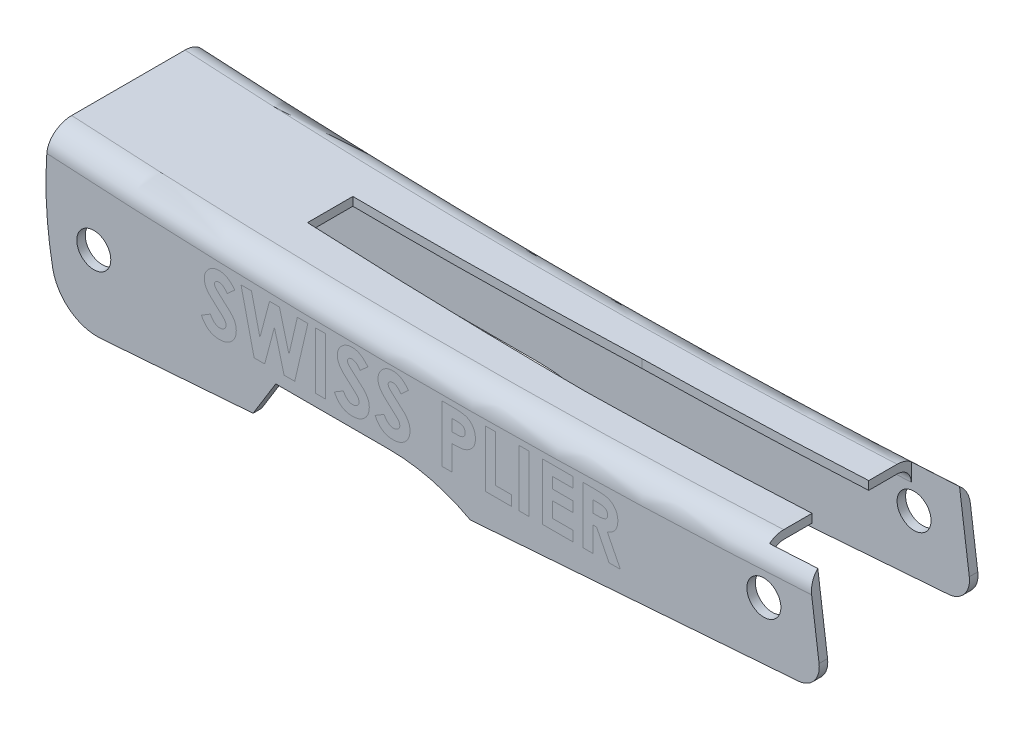
from build123d import *

# Parameters (mm, degrees)
BOSS_EXTRUDE1_DEPTH = 7
FILLET1_R           = 2
FILLET2_R           = 4
SHELL1_T            = -0.75
SKETCH4_R           = 1.5
CUT_EXTRUDE1_DEPTH  = 71.716642035
CUT_EXTRUDE2_DEPTH  = 14
CUT_EXTRUDE3_DEPTH  = 71.716642035


with BuildPart() as part:
    # Sketch3 → Boss-Extrude1 (new, symmetric)
    with BuildSketch(Plane.XY):
        with BuildLine():
            Line((67, 0), (68.2, -9))
            Line((68.2, -9), (1.2, -14))
            Line((1.2, -14), (0, 0))
            ThreePointArc((0, 0), (33.5, -1), (67, 0))
        make_face()
        with BuildLine():
            ThreePointArc((1.2, -14), (-0.147259987, -7.064050856), (0, 0))
            Line((0, 0), (1.2, -14))
        make_face()
    extrude(amount=BOSS_EXTRUDE1_DEPTH, both=True)

    # Fillet1
    fillet1_edges = [part.edges().sort_by_distance(p)[0] for p in [
        (33.5, -1, 7),
        (33.5, -1, -7),
        (68.2, -9, 0),
    ]]
    fillet(fillet1_edges, radius=FILLET1_R)

    # Fillet2
    fillet2_edges = [part.edges().sort_by_distance(p)[0] for p in [
        (1.2, -14, 0),
    ]]
    fillet(fillet2_edges, radius=FILLET2_R)

    # Shell1
    shell1_openings = [part.faces().sort_by_distance(p)[0] for p in [
        (67.467137389, -3.503530417, 0),
        (67.490186671, -8.423793277, 0),
        (1.829469038, -12.937587905, 0),
        (35.321845663, -11.453593607, 0),
        (-0.252281581, -5.271781297, 0),
    ]]
    offset(amount=SHELL1_T, openings=shell1_openings)

    # Sketch4 → Cut-Extrude1 (cut, through all)
    with BuildSketch(Plane.XY.offset(7)):
        with Locations((3.95, -7.3)):
            Circle(SKETCH4_R)
        with Locations((63.05, -4.3)):
            Circle(SKETCH4_R)
    extrude(amount=-CUT_EXTRUDE1_DEPTH, mode=Mode.SUBTRACT)

    # Sketch5 → Cut-Extrude2 (cut)
    with BuildSketch(Plane(origin=(0, 0, 0), x_dir=(1, 0, 0), z_dir=(0, 1, 0))):
        Polygon((17.8, -2), (17.8, 2), (42.8, 2.5), (62.8, 2.5), (62.8, 6.25), (67.8, 6.25), (67.8, -6.25), (62.8, -6.25), (62.8, -2.5), (42.8, -2.5), align=None)
    extrude(amount=-CUT_EXTRUDE2_DEPTH, mode=Mode.SUBTRACT)

    # Sketch6 → Cut-Extrude3 (cut, through all)
    with BuildSketch(Plane.XY.offset(7)):
        with BuildLine():
            Line((18, -12.746268657), (20, -9.5))
            Line((20, -9.5), (30, -9.5))
            ThreePointArc((30, -9.5), (33.691290315, -9.961280118), (37.155551452, -11.316749892))
            Line((37.155551452, -11.316749892), (18, -12.746268657))
        make_face()
    extrude(amount=-CUT_EXTRUDE3_DEPTH, mode=Mode.SUBTRACT)


solid = part.part
